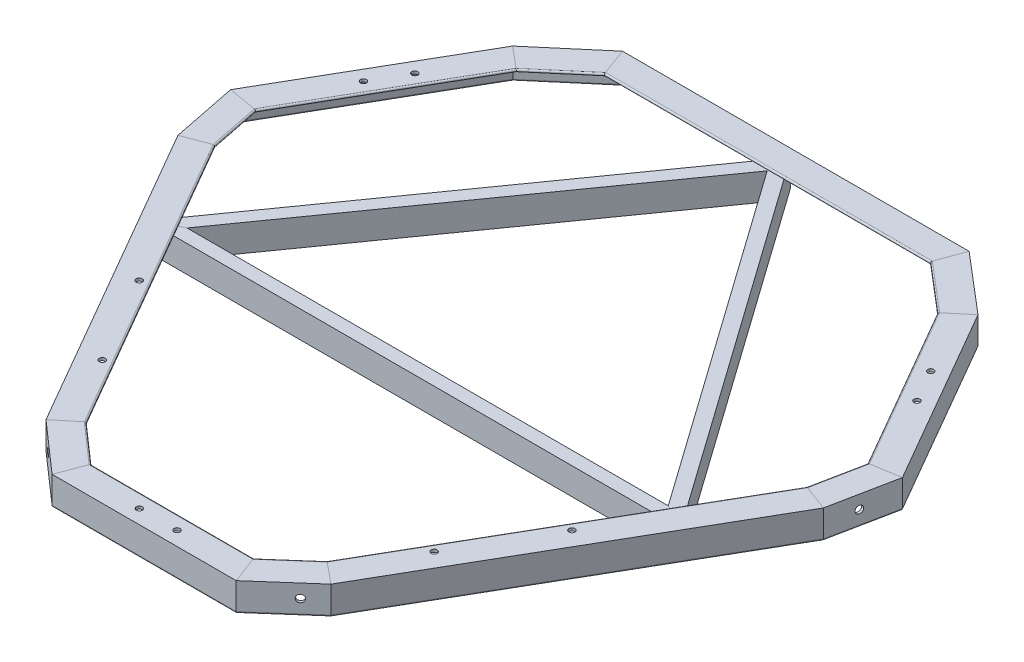
from build123d import *

# Parameters (mm, degrees)
MEMBER_1_DEPTH              = 269.921825596
MEMBER_1_DEPTH_BACK         = 11.921825596
MEMBER_1_2_DEPTH            = 76.056261206
MEMBER_1_3_DEPTH            = 171.97678954
MEMBER_1_4_DEPTH            = 68.083549797
MEMBER_1_5_DEPTH            = 280.018366446
MEMBER_1_6_DEPTH            = 68.083549797
MEMBER_1_7_DEPTH            = 161.406978889
MEMBER_1_8_DEPTH            = 68.083549797
MEMBER_1_9_DEPTH            = 280.018366446
MEMBER_1_10_DEPTH           = 68.083549797
MEMBER_1_11_DEPTH           = 171.97678954
MEMBER_1_12_DEPTH           = 76.056261206
MEMBER_3_DEPTH              = 387.41737101
MEMBER_3_DEPTH_BACK         = 32.556804877
MEMBER_3_2_DEPTH            = 485.30695813
MEMBER_3_3_DEPTH            = 419.974175887
SKETCH_17_W                 = 2.75
SKETCH_17_H                 = 334.017885345
SKETCH_19_W                 = 2.75
SKETCH_19_H                 = 11.429655408
SKETCH_21_W                 = 2.75
SKETCH_21_H                 = 239.249380404
SKETCH_24_W                 = 2.25
SKETCH_24_H                 = 2.001
HOLE_WIZARD_M4_1_AT_2_COUNT = 2
HOLE_WIZARD_M4_1_AT_2_PITCH = 75.055534995
HOLE_WIZARD_M4_1_AT_3_COUNT = 2
HOLE_WIZARD_M4_1_AT_3_PITCH = 291.857928583
HOLE_WIZARD_M4_1_AT_4_COUNT = 2
HOLE_WIZARD_M4_1_AT_4_PITCH = 322.055534995
SKETCH_26_W                 = 2.25
SKETCH_26_H                 = 2.001
HOLE_WIZARD_M4_2_AT_2_COUNT = 2
HOLE_WIZARD_M4_2_AT_2_PITCH = 406.864460324
HOLE_WIZARD_M4_2_AT_3_COUNT = 2
HOLE_WIZARD_M4_2_AT_3_PITCH = 422.307944061
MIRROR_2_COPY_1_SKETCH_W    = 2.25
MIRROR_2_COPY_1_SKETCH_H    = 2.001
MIRROR_2_COPY_2_SKETCH_W    = 2.25
MIRROR_2_COPY_2_SKETCH_H    = 2.001


with BuildPart() as part:
    # Sketch1 → Member 1 (new, two sides: drawn at the far end of the back side and taken through both)
    with BuildSketch(Plane(origin=(-129, 215, -220), x_dir=(0, 0, 1), z_dir=(1, 0, 0)).offset(-MEMBER_1_DEPTH_BACK)):
        with BuildLine():
            Line((-10, -10), (0, -10))
            Line((0, -10), (10, -10))
            ThreePointArc((10, -10), (11, -9), (10, -8))
            Line((10, -8), (0, -8))
            Line((0, -8), (-6, -8))
            ThreePointArc((-6, -8), (-7.414213562, -7.414213562), (-8, -6))
            Line((-8, -6), (-8, 5))
            Line((-8, 5), (-8, 10))
            ThreePointArc((-8, 10), (-9, 11), (-10, 10))
            Line((-10, 10), (-10, 5))
            Line((-10, 5), (-10, -10))
        make_face()
    extrude(amount=MEMBER_1_DEPTH + MEMBER_1_DEPTH_BACK)

    # Member 1 mitre 1
    split(bisect_by=Plane(origin=(-129, 225, -230), x_dir=(0, 1, 0), z_dir=(0.938545131, 0, -0.345156539)), keep=Keep.TOP)

    # Member 1 mitre 2
    split(bisect_by=Plane(origin=(129, 225, -230), x_dir=(0, -1, 0), z_dir=(-0.938545131, 0, -0.345156539)), keep=Keep.TOP)


with BuildPart() as body_2:
    # Sketch1 on segment 2 (carried to segment 2) → Member 1 2 (new body)
    with BuildSketch(Plane(origin=(113.439841185, 215, -230.106692065), x_dir=(-0.647889979, 0, 0.761733927), z_dir=(0.761733927, 0, 0.647889979))):
        with BuildLine():
            Line((-10, -10), (0, -10))
            Line((0, -10), (10, -10))
            ThreePointArc((10, -10), (11, -9), (10, -8))
            Line((10, -8), (0, -8))
            Line((0, -8), (-6, -8))
            ThreePointArc((-6, -8), (-7.414213562, -7.414213562), (-8, -6))
            Line((-8, -6), (-8, 5))
            Line((-8, 5), (-8, 10))
            ThreePointArc((-8, 10), (-9, 11), (-10, 10))
            Line((-10, 10), (-10, 5))
            Line((-10, 5), (-10, -10))
        make_face()
    extrude(amount=MEMBER_1_2_DEPTH)

    # Member 1 2 mitre 1
    split(bisect_by=Plane(origin=(173.180567757, 225, -192.422381227), x_dir=(0, -1, 0), z_dir=(-0.640225657, 0, -0.768186897)), keep=Keep.TOP)

    # Member 1 2 mitre 2
    split(bisect_by=Plane(origin=(129, 225, -230), x_dir=(0, 1, 0), z_dir=(0.938545131, 0, 0.345156539)), keep=Keep.TOP)


with BuildPart() as body_3:
    # Sketch1 on segment 3 (carried to segment 3) → Member 1 3 (new body)
    with BuildSketch(Plane(origin=(161.453095914, 215, -192.734958303), x_dir=(-0.866025404, 0, 0.5), z_dir=(0.5, 0, 0.866025404))):
        with BuildLine():
            Line((-10, -10), (0, -10))
            Line((0, -10), (10, -10))
            ThreePointArc((10, -10), (11, -9), (10, -8))
            Line((10, -8), (0, -8))
            Line((0, -8), (-6, -8))
            ThreePointArc((-6, -8), (-7.414213562, -7.414213562), (-8, -6))
            Line((-8, -6), (-8, 5))
            Line((-8, 5), (-8, 10))
            ThreePointArc((-8, 10), (-9, 11), (-10, 10))
            Line((-10, 10), (-10, 5))
            Line((-10, 5), (-10, -10))
        make_face()
    extrude(amount=MEMBER_1_3_DEPTH)

    # Member 1 3 mitre 1
    split(bisect_by=Plane(origin=(173.180567757, 225, -192.422381227), x_dir=(0, 1, 0), z_dir=(0.640225657, 0, 0.768186897)), keep=Keep.TOP)

    # Member 1 3 mitre 2
    split(bisect_by=Plane(origin=(250, 225, -59.367221574), x_dir=(0, 1, 0), z_dir=(-0.162145702, 0, -0.986766827)), keep=Keep.TOP)

    # 镜向2 copy 1 sketch → 镜向2 copy 1 (revolve, cut)
    with BuildSketch(Plane(origin=(205.987458364, 225, -114.219256391), x_dir=(0, 0, 1), z_dir=(-1, 0, 0))):
        with Locations((1.125, -1.0005)):
            Rectangle(MIRROR_2_COPY_1_SKETCH_W, MIRROR_2_COPY_1_SKETCH_H)
    revolve(axis=Axis((205.987458364, 231.35, -114.219256391), (0, 1, 0)), mode=Mode.SUBTRACT)

    # 镜向2 copy 2 sketch → 镜向2 copy 2 (revolve, cut)
    with BuildSketch(Plane(origin=(191.987458364, 225, -138.467967697), x_dir=(0, 0, 1), z_dir=(-1, 0, 0))):
        with Locations((1.125, -1.0005)):
            Rectangle(MIRROR_2_COPY_2_SKETCH_W, MIRROR_2_COPY_2_SKETCH_H)
    revolve(axis=Axis((191.987458364, 231.35, -138.467967697), (0, 1, 0)), mode=Mode.SUBTRACT)


with BuildPart() as body_4:
    # Sketch1 on segment 4 (carried to segment 4) → Member 1 4 (new body)
    with BuildSketch(Plane(origin=(242.594093192, 215, -73.298398802), x_dir=(-0.98048766, 0, -0.196580642), z_dir=(-0.196580642, 0, 0.98048766))):
        with BuildLine():
            Line((-10, -10), (0, -10))
            Line((0, -10), (10, -10))
            ThreePointArc((10, -10), (11, -9), (10, -8))
            Line((10, -8), (0, -8))
            Line((0, -8), (-6, -8))
            ThreePointArc((-6, -8), (-7.414213562, -7.414213562), (-8, -6))
            Line((-8, -6), (-8, 5))
            Line((-8, 5), (-8, 10))
            ThreePointArc((-8, 10), (-9, 11), (-10, 10))
            Line((-10, 10), (-10, 5))
            Line((-10, 5), (-10, -10))
        make_face()
    extrude(amount=MEMBER_1_4_DEPTH)

    # Member 1 4 mitre 1
    split(bisect_by=Plane(origin=(250, 225, -59.367221574), x_dir=(0, -1, 0), z_dir=(0.162145702, 0, 0.986766827)), keep=Keep.TOP)

    # Member 1 4 mitre 2
    split(bisect_by=Plane(origin=(240.170967896, 225, -10.34283858), x_dir=(0, 1, 0), z_dir=(0.352961116, 0, -0.935637991)), keep=Keep.TOP)


with BuildPart() as body_5:
    # Sketch1 on segment 5 (carried to segment 5) → Member 1 5 (new body)
    with BuildSketch(Plane(origin=(234.450744034, 215, -20.435120221), x_dir=(-0.866025404, 0, -0.5), z_dir=(-0.5, 0, 0.866025404))):
        with BuildLine():
            Line((-10, -10), (0, -10))
            Line((0, -10), (10, -10))
            ThreePointArc((10, -10), (11, -9), (10, -8))
            Line((10, -8), (0, -8))
            Line((0, -8), (-6, -8))
            ThreePointArc((-6, -8), (-7.414213562, -7.414213562), (-8, -6))
            Line((-8, -6), (-8, 5))
            Line((-8, 5), (-8, 10))
            ThreePointArc((-8, 10), (-9, 11), (-10, 10))
            Line((-10, 10), (-10, 5))
            Line((-10, 5), (-10, -10))
        make_face()
    extrude(amount=MEMBER_1_5_DEPTH)

    # Member 1 5 mitre 1
    split(bisect_by=Plane(origin=(240.170967896, 225, -10.34283858), x_dir=(0, -1, 0), z_dir=(-0.352961116, 0, 0.935637991)), keep=Keep.TOP)

    # Member 1 5 mitre 2
    split(bisect_by=Plane(origin=(106.041845025, 225, 221.975617006), x_dir=(0, 1, 0), z_dir=(0.633805711, 0, -0.773492289)), keep=Keep.TOP)


with BuildPart() as body_6:
    # Sketch1 on segment 6 (carried to segment 6) → Member 1 6 (new body)
    with BuildSketch(Plane(origin=(103.851934716, 215, 210.583540699), x_dir=(-0.66048766, 0, -0.750836901), z_dir=(-0.750836901, 0, 0.66048766))):
        with BuildLine():
            Line((-10, -10), (0, -10))
            Line((0, -10), (10, -10))
            ThreePointArc((10, -10), (11, -9), (10, -8))
            Line((10, -8), (0, -8))
            Line((0, -8), (-6, -8))
            ThreePointArc((-6, -8), (-7.414213562, -7.414213562), (-8, -6))
            Line((-8, -6), (-8, 5))
            Line((-8, 5), (-8, 10))
            ThreePointArc((-8, 10), (-9, 11), (-10, 10))
            Line((-10, 10), (-10, 5))
            Line((-10, 5), (-10, -10))
        make_face()
    extrude(amount=MEMBER_1_6_DEPTH)

    # Member 1 6 mitre 1
    split(bisect_by=Plane(origin=(68.5, 225, 255), x_dir=(0, 1, 0), z_dir=(0.935637991, 0, -0.352961116)), keep=Keep.TOP)

    # Member 1 6 mitre 2
    split(bisect_by=Plane(origin=(106.041845025, 225, 221.975617006), x_dir=(0, -1, 0), z_dir=(-0.633805711, 0, 0.773492289)), keep=Keep.TOP)


with BuildPart() as body_7:
    # Sketch1 on segment 7 (carried to segment 7) → Member 1 7 (new body)
    with BuildSketch(Plane(origin=(80.703489444, 215, 245), x_dir=(0, 0, -1), z_dir=(-1, 0, 0))):
        with BuildLine():
            Line((-10, -10), (0, -10))
            Line((0, -10), (10, -10))
            ThreePointArc((10, -10), (11, -9), (10, -8))
            Line((10, -8), (0, -8))
            Line((0, -8), (-6, -8))
            ThreePointArc((-6, -8), (-7.414213562, -7.414213562), (-8, -6))
            Line((-8, -6), (-8, 5))
            Line((-8, 5), (-8, 10))
            ThreePointArc((-8, 10), (-9, 11), (-10, 10))
            Line((-10, 10), (-10, 5))
            Line((-10, 5), (-10, -10))
        make_face()
    extrude(amount=MEMBER_1_7_DEPTH)

    # Member 1 7 mitre 1
    split(bisect_by=Plane(origin=(-68.5, 225, 255), x_dir=(0, 1, 0), z_dir=(0.935637991, 0, 0.352961116)), keep=Keep.TOP)

    # Member 1 7 mitre 2
    split(bisect_by=Plane(origin=(68.5, 225, 255), x_dir=(0, -1, 0), z_dir=(-0.935637991, 0, 0.352961116)), keep=Keep.TOP)

    # 草图26 → M4 间隙孔2 (revolve, cut)
    with BuildSketch(Plane(origin=(-14, 225, 244.5), x_dir=(0, 0, 1), z_dir=(1, 0, 0))):
        with Locations((1.125, 1.0005)):
            Rectangle(SKETCH_26_W, SKETCH_26_H)
    hole_wizard_m4_2 = revolve(axis=Axis((-14, 231.35, 244.5), (0, -1, 0)), mode=Mode.SUBTRACT)


with BuildPart() as body_8:
    # Sketch1 on segment 8 (carried to segment 8) → Member 1 8 (new body)
    with BuildSketch(Plane(origin=(-52.732293211, 215, 255.55188518), x_dir=(0.66048766, 0, -0.750836901), z_dir=(-0.750836901, 0, -0.66048766))):
        with BuildLine():
            Line((-10, -10), (0, -10))
            Line((0, -10), (10, -10))
            ThreePointArc((10, -10), (11, -9), (10, -8))
            Line((10, -8), (0, -8))
            Line((0, -8), (-6, -8))
            ThreePointArc((-6, -8), (-7.414213562, -7.414213562), (-8, -6))
            Line((-8, -6), (-8, 5))
            Line((-8, 5), (-8, 10))
            ThreePointArc((-8, 10), (-9, 11), (-10, 10))
            Line((-10, 10), (-10, 5))
            Line((-10, 5), (-10, -10))
        make_face()
    extrude(amount=MEMBER_1_8_DEPTH)

    # Member 1 8 mitre 1
    split(bisect_by=Plane(origin=(-68.5, 225, 255), x_dir=(0, -1, 0), z_dir=(-0.935637991, 0, -0.352961116)), keep=Keep.TOP)

    # Member 1 8 mitre 2
    split(bisect_by=Plane(origin=(-106.041845025, 225, 221.975617006), x_dir=(0, 1, 0), z_dir=(0.633805711, 0, 0.773492289)), keep=Keep.TOP)

    # 草图21 → M5 间隙孔3 (revolve, cut)
    with BuildSketch(Plane(origin=(-93.921773915, 215, 232.63726323), x_dir=(0.750836900504102, 0, 0.6604876598706394), z_dir=(0, 1, 0))):
        with Locations((1.375, 119.624690202)):
            Rectangle(SKETCH_21_W, SKETCH_21_H)
    hole_wizard_m5_3 = revolve(axis=Axis((-98.115870556, 215, 237.405077548), (0.6604876598706394, -7.459766254699225e-15, -0.7508369005041018)), mode=Mode.SUBTRACT)


with BuildPart() as body_9:
    # Sketch1 on segment 9 (carried to segment 9) → Member 1 9 (new body)
    with BuildSketch(Plane(origin=(-94.441560811, 215, 222.067898647), x_dir=(0.866025404, 0, -0.5), z_dir=(-0.5, 0, -0.866025404))):
        with BuildLine():
            Line((-10, -10), (0, -10))
            Line((0, -10), (10, -10))
            ThreePointArc((10, -10), (11, -9), (10, -8))
            Line((10, -8), (0, -8))
            Line((0, -8), (-6, -8))
            ThreePointArc((-6, -8), (-7.414213562, -7.414213562), (-8, -6))
            Line((-8, -6), (-8, 5))
            Line((-8, 5), (-8, 10))
            ThreePointArc((-8, 10), (-9, 11), (-10, 10))
            Line((-10, 10), (-10, 5))
            Line((-10, 5), (-10, -10))
        make_face()
    extrude(amount=MEMBER_1_9_DEPTH)

    # Member 1 9 mitre 1
    split(bisect_by=Plane(origin=(-240.170967896, 225, -10.34283858), x_dir=(0, -1, 0), z_dir=(0.352961116, 0, 0.935637991)), keep=Keep.TOP)

    # Member 1 9 mitre 2
    split(bisect_by=Plane(origin=(-106.041845025, 225, 221.975617006), x_dir=(0, -1, 0), z_dir=(-0.633805711, 0, -0.773492289)), keep=Keep.TOP)

    # 草图24 → M4 间隙孔1 (revolve, cut)
    with BuildSketch(Plane(origin=(-161.027767497, 225, 97.623753223), x_dir=(0, 0, 1), z_dir=(1, 0, 0))):
        with Locations((1.125, 1.0005)):
            Rectangle(SKETCH_24_W, SKETCH_24_H)
    hole_wizard_m4_1 = revolve(axis=Axis((-161.027767497, 231.35, 97.623753223), (0, -1, 0)), mode=Mode.SUBTRACT)

    # M4 间隙孔1 at 2: M4 间隙孔1 ×2
    with Locations(*[Vector(0.49999999999999806, 4.733446612636473e-15, 0.8660254037844398) * (i * HOLE_WIZARD_M4_1_AT_2_PITCH) for i in range(1, HOLE_WIZARD_M4_1_AT_2_COUNT)]):
        add(hole_wizard_m4_1, mode=Mode.SUBTRACT)


with BuildPart() as body_10:
    # Sketch1 on segment 10 (carried to segment 10) → Member 1 10 (new body)
    with BuildSketch(Plane(origin=(-229.210185258, 215, -6.543318386), x_dir=(0.98048766, 0, -0.196580642), z_dir=(-0.196580642, 0, -0.98048766))):
        with BuildLine():
            Line((-10, -10), (0, -10))
            Line((0, -10), (10, -10))
            ThreePointArc((10, -10), (11, -9), (10, -8))
            Line((10, -8), (0, -8))
            Line((0, -8), (-6, -8))
            ThreePointArc((-6, -8), (-7.414213562, -7.414213562), (-8, -6))
            Line((-8, -6), (-8, 5))
            Line((-8, 5), (-8, 10))
            ThreePointArc((-8, 10), (-9, 11), (-10, 10))
            Line((-10, 10), (-10, 5))
            Line((-10, 5), (-10, -10))
        make_face()
    extrude(amount=MEMBER_1_10_DEPTH)

    # Member 1 10 mitre 1
    split(bisect_by=Plane(origin=(-250, 225, -59.367221574), x_dir=(0, -1, 0), z_dir=(-0.162145702, 0, 0.986766827)), keep=Keep.TOP)

    # Member 1 10 mitre 2
    split(bisect_by=Plane(origin=(-240.170967896, 225, -10.34283858), x_dir=(0, 1, 0), z_dir=(-0.352961116, 0, -0.935637991)), keep=Keep.TOP)

    # 草图19 → M5 间隙孔2 (revolve, cut)
    with BuildSketch(Plane(origin=(-244.643234153, 215, -32.649215396), x_dir=(0.19658064208206094, 0, 0.9804876598706405), z_dir=(0, 1, 0))):
        with Locations((1.375, 5.714827704)):
            Rectangle(SKETCH_19_W, SKETCH_19_H)
    hole_wizard_m5_2 = revolve(axis=Axis((-250.869330793, 215, -31.400928319), (0.9804876598706403, -7.459766254699225e-15, -0.19658064208206094)), mode=Mode.SUBTRACT)


with BuildPart() as body_11:
    # Sketch1 on segment 11 (carried to segment 11) → Member 1 11 (new body)
    with BuildSketch(Plane(origin=(-247.441490684, 215, -43.7986897), x_dir=(0.866025404, 0, 0.5), z_dir=(0.5, 0, -0.866025404))):
        with BuildLine():
            Line((-10, -10), (0, -10))
            Line((0, -10), (10, -10))
            ThreePointArc((10, -10), (11, -9), (10, -8))
            Line((10, -8), (0, -8))
            Line((0, -8), (-6, -8))
            ThreePointArc((-6, -8), (-7.414213562, -7.414213562), (-8, -6))
            Line((-8, -6), (-8, 5))
            Line((-8, 5), (-8, 10))
            ThreePointArc((-8, 10), (-9, 11), (-10, 10))
            Line((-10, 10), (-10, 5))
            Line((-10, 5), (-10, -10))
        make_face()
    extrude(amount=MEMBER_1_11_DEPTH)

    # Member 1 11 mitre 1
    split(bisect_by=Plane(origin=(-173.180567757, 225, -192.422381227), x_dir=(0, -1, 0), z_dir=(-0.640225657, 0, 0.768186897)), keep=Keep.TOP)

    # Member 1 11 mitre 2
    split(bisect_by=Plane(origin=(-250, 225, -59.367221574), x_dir=(0, 1, 0), z_dir=(0.162145702, 0, -0.986766827)), keep=Keep.TOP)

    # M4 间隙孔2 at 2: M4 间隙孔2 ×2
    with Locations(*[Vector(-0.47187079994920367, -4.822210638779651e-15, -0.8816677084680479) * (i * HOLE_WIZARD_M4_2_AT_2_PITCH) for i in range(1, HOLE_WIZARD_M4_2_AT_2_COUNT)]):
        add(hole_wizard_m4_2, mode=Mode.SUBTRACT)

    # M4 间隙孔2 at 3: M4 间隙孔2 ×2
    with Locations(*[Vector(-0.4214636756594446, -4.961339045446752e-15, -0.9068452845439682) * (i * HOLE_WIZARD_M4_2_AT_3_PITCH) for i in range(1, HOLE_WIZARD_M4_2_AT_3_COUNT)]):
        add(hole_wizard_m4_2, mode=Mode.SUBTRACT)


with BuildPart() as body_12:
    # Sketch1 on segment 12 (carried to segment 12) → Member 1 12 (new body)
    with BuildSketch(Plane(origin=(-171.374475695, 215, -180.830602601), x_dir=(0.647889979, 0, 0.761733927), z_dir=(0.761733927, 0, -0.647889979))):
        with BuildLine():
            Line((-10, -10), (0, -10))
            Line((0, -10), (10, -10))
            ThreePointArc((10, -10), (11, -9), (10, -8))
            Line((10, -8), (0, -8))
            Line((0, -8), (-6, -8))
            ThreePointArc((-6, -8), (-7.414213562, -7.414213562), (-8, -6))
            Line((-8, -6), (-8, 5))
            Line((-8, 5), (-8, 10))
            ThreePointArc((-8, 10), (-9, 11), (-10, 10))
            Line((-10, 10), (-10, 5))
            Line((-10, 5), (-10, -10))
        make_face()
    extrude(amount=MEMBER_1_12_DEPTH)

    # Member 1 12 mitre 1
    split(bisect_by=Plane(origin=(-173.180567757, 225, -192.422381227), x_dir=(0, 1, 0), z_dir=(0.640225657, 0, -0.768186897)), keep=Keep.TOP)

    # Member 1 12 mitre 2
    split(bisect_by=Plane(origin=(-129, 225, -230), x_dir=(0, -1, 0), z_dir=(-0.938545131, 0, 0.345156539)), keep=Keep.TOP)

    # 草图17 → M5 间隙孔1 (revolve, cut)
    with BuildSketch(Plane(origin=(-153.181216679, 215, -209.432755441), x_dir=(-0.7617339268477308, 0, 0.6478899788460508), z_dir=(0, 1, 0))):
        with Locations((1.375, 167.008942673)):
            Rectangle(SKETCH_17_W, SKETCH_17_H)
    hole_wizard_m5_1 = revolve(axis=Axis((-157.295318044, 215, -214.269765876), (0.6478899788460508, -7.459766254699225e-15, 0.7617339268477307)), mode=Mode.SUBTRACT)


with BuildPart() as body_13:
    # Sketch13 → Member 3 (new, two sides: drawn at the far end of the back side and taken through both)
    with BuildSketch(Plane(origin=(4.079638001, 213, -223.109229553), x_dir=(0, -1, 0), z_dir=(-0.5781540894291658, 0, 0.8159276002663055)).offset(-MEMBER_3_DEPTH_BACK)):
        Polygon((-10, -5), (0, -5), (10, -5), (10, 0), (10, 5), (0, 5), (-10, 5), (-10, 0), align=None)
        Polygon((-9, 4), (0, 4), (9, 4), (9, 0), (9, -4), (0, -4), (-9, -4), (-9, 0), align=None, mode=Mode.SUBTRACT)
    extrude(amount=MEMBER_3_DEPTH + MEMBER_3_DEPTH_BACK)

    # Member 3 mitre 1
    split(bisect_by=Plane(origin=(0, 223, -226), x_dir=(0, -1, 0), z_dir=(-1, 0, 0)), keep=Keep.TOP)

    # Member 3 mitre 2
    split(bisect_by=Plane(origin=(-198.403810568, 223, 54), x_dir=(0, -1, 0), z_dir=(-0.459263492, 0, -0.888300087)), keep=Keep.TOP)


with BuildPart() as body_14:
    # Sketch13 on segment 2 (carried to segment 2) → Member 3 2 (new body)
    with BuildSketch(Plane(origin=(-242.653479065, 213, 49), x_dir=(0, -1, 0), z_dir=(1, 0, 0))):
        Polygon((-10, -5), (0, -5), (10, -5), (10, 0), (10, 5), (0, 5), (-10, 5), (-10, 0), align=None)
        Polygon((-9, 4), (0, 4), (9, 4), (9, 0), (9, -4), (0, -4), (-9, -4), (-9, 0), align=None, mode=Mode.SUBTRACT)
    extrude(amount=MEMBER_3_2_DEPTH)

    # Member 3 2 mitre 1
    split(bisect_by=Plane(origin=(-198.403810568, 223, 54), x_dir=(0, 1, 0), z_dir=(0.459263492, 0, 0.888300087)), keep=Keep.TOP)

    # Member 3 2 mitre 2
    split(bisect_by=Plane(origin=(198.403810568, 223, 54), x_dir=(0, -1, 0), z_dir=(-0.459263492, 0, 0.888300087)), keep=Keep.TOP)


with BuildPart() as body_15:
    # Sketch13 on segment 3 (carried to segment 3) → Member 3 3 (new body)
    with BuildSketch(Plane(origin=(219.907299364, 213, 92.995296277), x_dir=(0, -1, 0), z_dir=(-0.578154089, 0, -0.8159276))):
        Polygon((-10, -5), (0, -5), (10, -5), (10, 0), (10, 5), (0, 5), (-10, 5), (-10, 0), align=None)
        Polygon((-9, 4), (0, 4), (9, 4), (9, 0), (9, -4), (0, -4), (-9, -4), (-9, 0), align=None, mode=Mode.SUBTRACT)
    extrude(amount=MEMBER_3_3_DEPTH)

    # Member 3 3 mitre 1
    split(bisect_by=Plane(origin=(0, 223, -226), x_dir=(0, 1, 0), z_dir=(1, 0, 0)), keep=Keep.TOP)

    # Member 3 3 mitre 2
    split(bisect_by=Plane(origin=(198.403810568, 223, 54), x_dir=(0, 1, 0), z_dir=(0.459263492, 0, -0.888300087)), keep=Keep.TOP)


with BuildPart() as body_5_1:
    add(body_5.part)

    # M4 间隙孔1 at 3: M4 间隙孔1 ×2
    with Locations(*[Vector(0.974884488759017, 1.2172750269434246e-15, 0.22271109890858617) * (i * HOLE_WIZARD_M4_1_AT_3_PITCH) for i in range(1, HOLE_WIZARD_M4_1_AT_3_COUNT)]):
        add(hole_wizard_m4_1, mode=Mode.SUBTRACT)

    # M4 间隙孔1 at 4: M4 间隙孔1 ×2
    with Locations(*[(i * HOLE_WIZARD_M4_1_AT_4_PITCH, 0, 0) for i in range(1, HOLE_WIZARD_M4_1_AT_4_COUNT)]):
        add(hole_wizard_m4_1, mode=Mode.SUBTRACT)


with BuildPart() as mirror_2_tool:
    # 镜向2: M5 间隙孔1, M5 间隙孔2, M5 间隙孔3, M4 间隙孔2 across plane
    add(hole_wizard_m5_1.mirror(Plane(origin=(0, 0, 0), x_dir=(0, 0, 1), z_dir=(1, 0, 0))))
    add(hole_wizard_m5_2.mirror(Plane(origin=(0, 0, 0), x_dir=(0, 0, 1), z_dir=(1, 0, 0))))
    add(hole_wizard_m5_3.mirror(Plane(origin=(0, 0, 0), x_dir=(0, 0, 1), z_dir=(1, 0, 0))))
    add(hole_wizard_m4_2.mirror(Plane(origin=(0, 0, 0), x_dir=(0, 0, 1), z_dir=(1, 0, 0))))


with BuildPart() as body_2_1:
    add(body_2.part)

    # 镜向2: cut by mirror_2_tool
    add(mirror_2_tool.part, mode=Mode.SUBTRACT)


with BuildPart() as body_4_1:
    add(body_4.part)

    # 镜向2: cut by mirror_2_tool
    add(mirror_2_tool.part, mode=Mode.SUBTRACT)


with BuildPart() as body_6_1:
    add(body_6.part)

    # 镜向2: cut by mirror_2_tool
    add(mirror_2_tool.part, mode=Mode.SUBTRACT)


with BuildPart() as body_7_1:
    add(body_7.part)

    # 镜向2: cut by mirror_2_tool
    add(mirror_2_tool.part, mode=Mode.SUBTRACT)


solid = Compound([part.part, body_3.part, body_8.part, body_9.part, body_10.part, body_11.part, body_12.part, body_13.part, body_14.part, body_15.part, body_5_1.part, body_2_1.part, body_4_1.part, body_6_1.part, body_7_1.part])
